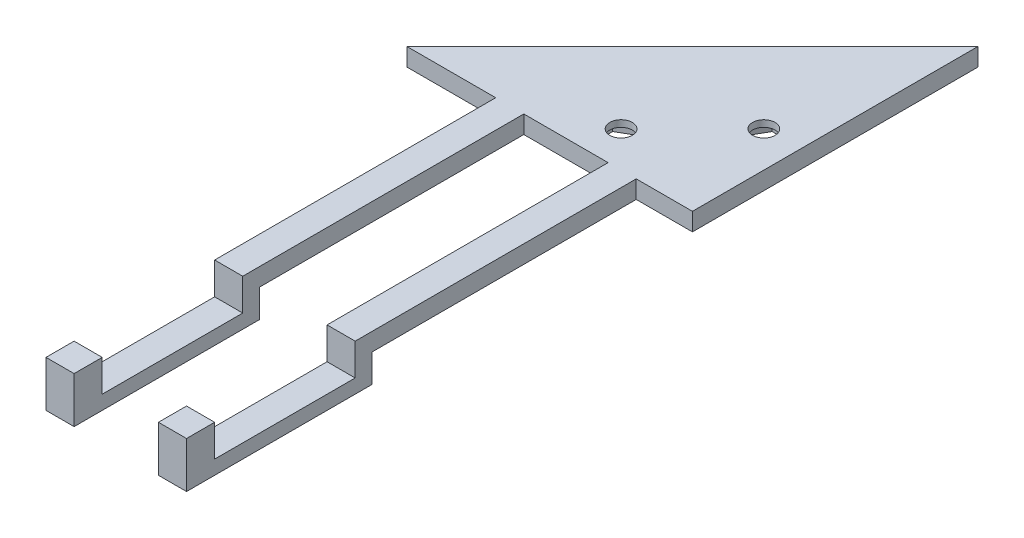
from build123d import *

# Parameters (mm, degrees)
BOSS_EXTRUDE1_DEPTH     = 3.175
SKETCH2_R               = 2
CUT_EXTRUDE1_DEPTH      = 72.912172996
CUT_EXTRUDE2_START      = -3.175
CUT_EXTRUDE2_DEPTH      = 2
BOSS_EXTRUDE2_START     = 10
BOSS_EXTRUDE2_DEPTH     = 5
BOSS_EXTRUDE3_START     = 30
BOSS_EXTRUDE3_DEPTH     = 5
CUT_EXTRUDE3_DEPTH      = 95.89805056
CUT_EXTRUDE3_DEPTH_BACK = 95.89805056
SKETCH6_W               = 69.501005266
SKETCH6_H               = 136.605424145


with BuildPart() as part:
    # Sketch1 → Boss-Extrude1 (new body)
    with BuildSketch(Plane(origin=(0, 0, 0), x_dir=(1, 0, 0), z_dir=(0, 1, 0))):
        Polygon((0, 0), (50.8, 0), (0, 50.8), align=None)
    extrude(amount=BOSS_EXTRUDE1_DEPTH)

    # Sketch2 → Cut-Extrude1 (cut, through all)
    with BuildSketch(Plane(origin=(0, 3.175, 0), x_dir=(1, 0, 0), z_dir=(0, 1, 0))):
        with Locations(Location((19.05, 6.35, 0), (0, 0, 270))):
            Circle(SKETCH2_R)
        with Locations(Location((6.35, 19.05, 0), (0, 0, 90))):
            Circle(SKETCH2_R)
    extrude(amount=-CUT_EXTRUDE1_DEPTH, mode=Mode.SUBTRACT)

    # Sketch3 → Cut-Extrude2 (cut)
    with BuildSketch(Plane(origin=(0, 3.175, 0), x_dir=(1, 0, 0), z_dir=(0, 1, 0)).offset(CUT_EXTRUDE2_START)):
        Polygon((8.370723055, 15.550005), (10.391446111, 19.05), (8.370723055, 22.549995), (4.329276945, 22.549995), (2.308553889, 19.05), (4.329276945, 15.550005), align=None)
        Polygon((22.549995, 4.329276945), (19.05, 2.308553889), (15.550005, 4.329276945), (15.550005, 8.370723055), (19.05, 10.391446111), (22.549995, 8.370723055), align=None)
    extrude(amount=CUT_EXTRUDE2_DEPTH, mode=Mode.SUBTRACT)

    # Sketch5 → Boss-Extrude2 (add)
    with BuildSketch(Plane(origin=(0, 0, 0), x_dir=(0, 0, -1), z_dir=(1, 0, 0)).offset(BOSS_EXTRUDE2_START)):
        Polygon((0, 0), (0, 3.175), (-50, 3.175), (-50, -2.5), (-75, -2.5), (-75, 3.175), (-80, 3.175), (-80, -5), (-47, -5), (-47, 0), align=None)
    extrude(amount=BOSS_EXTRUDE2_DEPTH)

    # Sketch5<3> → Boss-Extrude3 (add)
    with BuildSketch(Plane(origin=(0, 0, 0), x_dir=(0, 0, -1), z_dir=(1, 0, 0)).offset(BOSS_EXTRUDE3_START)):
        Polygon((0, 0), (0, 3.175), (-50, 3.175), (-50, -2.5), (-75, -2.5), (-75, 3.175), (-80, 3.175), (-80, -5), (-47, -5), (-47, 0), align=None)
    extrude(amount=BOSS_EXTRUDE3_DEPTH)

    # Mirror1: part across plane


with BuildPart() as part_1:
    add(part.part)
    add(part.part.mirror(Plane(origin=(0, 0, 0), x_dir=(0, 0, 1), z_dir=(1, 0, 0))))

    # Sketch6 → Cut-Extrude3 (cut, two sides: drawn at the far end of the back side and taken through both)
    with BuildSketch(Plane(origin=(0, 0, 0), x_dir=(1, 0, 0), z_dir=(0, 1, 0)).offset(-CUT_EXTRUDE3_DEPTH_BACK)):
        with Locations((34.750502633, -15.898150961)):
            Rectangle(SKETCH6_W, SKETCH6_H)
    extrude(amount=CUT_EXTRUDE3_DEPTH + CUT_EXTRUDE3_DEPTH_BACK, mode=Mode.SUBTRACT)


solid = part_1.part
